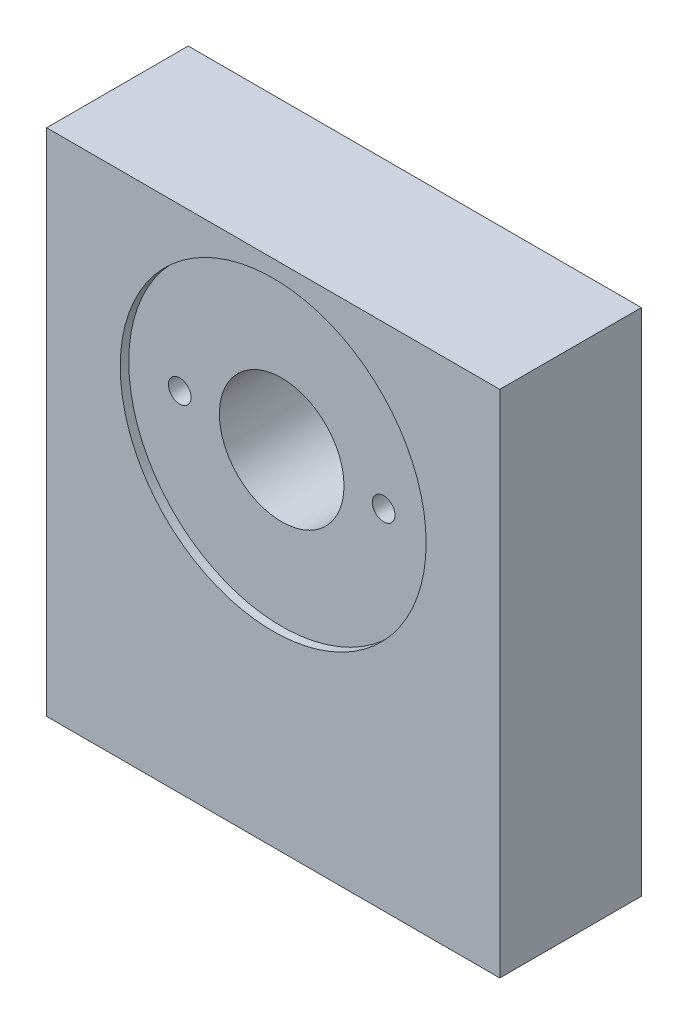
from build123d import *

# Parameters (mm, degrees)
SKETCH_5_W          = 80
SKETCH_5_H          = 25
EXTRUDE_4_DEPTH     = 90
SKETCH_6_R          = 2
SKETCH_6_R_2        = 11
CUT_EXTRUDE_1_DEPTH = 90
SKETCH_6_3_R        = 27
SKETCH_6_3_R_2      = 2
SKETCH_6_3_R_3      = 11
CUT_EXTRUDE_2_DEPTH = 1.5


with BuildPart() as part:
    # 草图5 → 凸台-拉伸4 (new body)
    with BuildSketch(Plane(origin=(0, 0, 0), x_dir=(1, 0, 0), z_dir=(0, 1, 0))):
        Rectangle(SKETCH_5_W, SKETCH_5_H)
    extrude(amount=EXTRUDE_4_DEPTH)

    # 草图6 → 切除-拉伸1 (cut)
    with BuildSketch(Plane.XY.offset(12.5)):
        with Locations((-18, 60)):
            Circle(SKETCH_6_R)
        with Locations((0, 60)):
            Circle(SKETCH_6_R_2)
        with Locations((18, 60)):
            Circle(SKETCH_6_R)
    extrude(amount=-CUT_EXTRUDE_1_DEPTH, mode=Mode.SUBTRACT)

    # 草图6<3> → 切除-拉伸2 (cut)
    with BuildSketch(Plane.XY.offset(12.5)):
        with Locations((0, 60)):
            Circle(SKETCH_6_3_R)
        with Locations((-18, 60)):
            Circle(SKETCH_6_3_R_2, mode=Mode.SUBTRACT)
        with Locations((0, 60)):
            Circle(SKETCH_6_3_R_3, mode=Mode.SUBTRACT)
        with Locations((18, 60)):
            Circle(SKETCH_6_3_R_2, mode=Mode.SUBTRACT)
    extrude(amount=-CUT_EXTRUDE_2_DEPTH, mode=Mode.SUBTRACT)


solid = part.part
